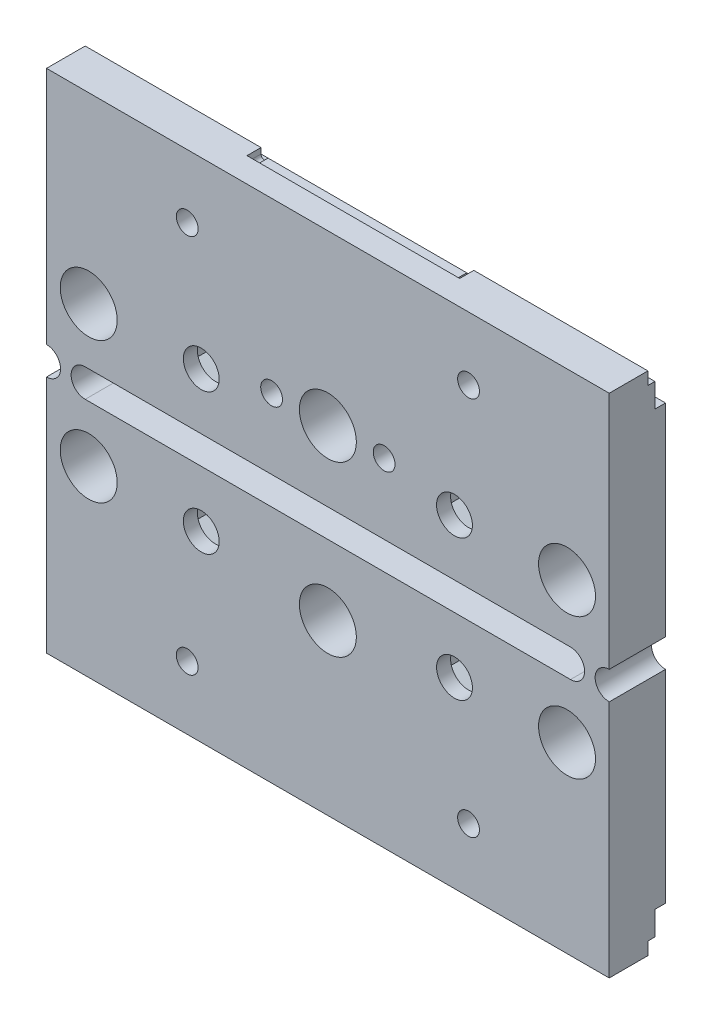
from build123d import *

# Parameters (mm, degrees)
SKETCH_2_W           = 80
SKETCH_2_H           = 34
SKETCH_2_R           = 4.05
EXTRUDE_1_DEPTH      = 8
SKETCH_3_R           = 2.55
CUT_EXTRUDE_1_DEPTH  = 88.292611371
CUT_EXTRUDE_2_DEPTH  = 88.292611371
SKETCH_5_R           = 1.55
CUT_EXTRUDE_3_DEPTH  = 88.292611371
CUT_EXTRUDE_4_DEPTH  = 6
CUT_EXTRUDE_5_DEPTH  = 4.5
SKETCH_25_R          = 1.55
CUT_EXTRUDE_13_DEPTH = 88.292611371
CUT_EXTRUDE_11_DEPTH = 2
EXTRUDE_2_DEPTH      = 8


with BuildPart() as part:
    # 草图2 → 凸台-拉伸1 (new body)
    with BuildSketch(Plane.XY):
        with Locations((40, 17)):
            Rectangle(SKETCH_2_W, SKETCH_2_H)
        with Locations((6, 8)):
            Circle(SKETCH_2_R, mode=Mode.SUBTRACT)
        with Locations((40, 10)):
            Circle(SKETCH_2_R, mode=Mode.SUBTRACT)
        with Locations((74, 8)):
            Circle(SKETCH_2_R, mode=Mode.SUBTRACT)
    extrude_1 = extrude(amount=EXTRUDE_1_DEPTH)

    # 草图3 → 切除-拉伸1 (cut, through all)
    with BuildSketch(Plane.XY.offset(8)):
        with Locations((22, 8)):
            Circle(SKETCH_3_R)
        with Locations((58, 8)):
            Circle(SKETCH_3_R)
    cut_extrude_1 = extrude(amount=-CUT_EXTRUDE_1_DEPTH, mode=Mode.SUBTRACT)

    # 草图4 → 切除-拉伸2 (cut, through all)
    with BuildSketch(Plane(origin=(80, 0, 0), x_dir=(0, 0, -1), z_dir=(1, 0, 0))):
        Polygon((-1.5, 32.2), (-2.5, 32.2), (-2.5, 34), (0, 34), (0, 28.8), (-1.5, 28.8), align=None)
    cut_extrude_2 = extrude(amount=-CUT_EXTRUDE_2_DEPTH, mode=Mode.SUBTRACT)

    # 草图5 → 切除-拉伸3 (cut, through all)
    with BuildSketch(Plane.XY.offset(8)):
        with Locations((48, 10)):
            Circle(SKETCH_5_R)
        with Locations((32, 10)):
            Circle(SKETCH_5_R)
    extrude(amount=-CUT_EXTRUDE_3_DEPTH, mode=Mode.SUBTRACT)

    # 草图7 → 切除-拉伸4 (cut)
    with BuildSketch(Plane(origin=(0, 0, 0), x_dir=(-1, 0, 0), z_dir=(0, 0, -1))):
        Polygon((-53.9, 5.632863896), (-53.9, 10.367136104), (-58, 12.734272207), (-62.1, 10.367136104), (-62.1, 5.632863896), (-58, 3.265727793), align=None)
        Polygon((-26.1, 5.632863896), (-22, 3.265727793), (-17.9, 5.632863896), (-17.9, 10.367136104), (-22, 12.734272207), (-26.1, 10.367136104), align=None)
    cut_extrude_4 = extrude(amount=-CUT_EXTRUDE_4_DEPTH, mode=Mode.SUBTRACT)

    # 草图8 → 切除-拉伸5 (cut)
    with BuildSketch(Plane(origin=(0, 0, 0), x_dir=(-1, 0, 0), z_dir=(0, 0, -1))):
        Polygon((-48, 6.709103466), (-45.15, 8.354551733), (-45.15, 11.645448267), (-48, 13.290896534), (-50.85, 11.645448267), (-50.85, 8.354551733), align=None)
        Polygon((-32, 6.709103466), (-29.15, 8.354551733), (-29.15, 11.645448267), (-32, 13.290896534), (-34.85, 11.645448267), (-34.85, 8.354551733), align=None)
    extrude(amount=-CUT_EXTRUDE_5_DEPTH, mode=Mode.SUBTRACT)

    # 草图25 → 切除-拉伸13 (cut, through all)
    with BuildSketch(Plane(origin=(0, 0, 0), x_dir=(-1, 0, 0), z_dir=(0, 0, -1))):
        with Locations((-60, 25)):
            Circle(SKETCH_25_R)
        with Locations((-20, 25)):
            Circle(SKETCH_25_R)
    cut_extrude_13 = extrude(amount=-CUT_EXTRUDE_13_DEPTH, mode=Mode.SUBTRACT)

    # 草图19 → 切除-拉伸11 (cut)
    with BuildSketch(Plane(origin=(0, 0, 2.5), x_dir=(-1, 0, 0), z_dir=(0, 0, -1))):
        with BuildLine():
            Line((-25, 34), (-55.247938178, 34))
            Line((-55.247938178, 34), (-55.247938178, 33.2))
            ThreePointArc((-55.247938178, 33.2), (-54.747938178, 32.7), (-54.247938178, 33.2))
            Line((-54.247938178, 33.2), (-26, 33.2))
            ThreePointArc((-26, 33.2), (-25.5, 32.7), (-25, 33.2))
            Line((-25, 33.2), (-25, 34))
        make_face()
    cut_extrude_11 = extrude(amount=-CUT_EXTRUDE_11_DEPTH, mode=Mode.SUBTRACT)

    # 草图22 → 凸台-拉伸2 (add)
    with BuildSketch(Plane.XY.offset(8)):
        with BuildLine():
            Line((0, -4), (5.5, -4))
            ThreePointArc((5.5, -4), (3.5, -2), (5.5, 0))
            Line((5.5, 0), (0, 0))
            ThreePointArc((0, 0), (2, -2), (0, -4))
        make_face()
        with BuildLine():
            Line((80, 0), (74.5, 0))
            ThreePointArc((74.5, 0), (76.5, -2), (74.5, -4))
            Line((74.5, -4), (80, -4))
            ThreePointArc((80, -4), (78, -2), (80, 0))
        make_face()
    extrude(amount=-EXTRUDE_2_DEPTH)

    # 镜向2: 凸台-拉伸1, 切除-拉伸1, 切除-拉伸2, 切除-拉伸4, 切除-拉伸13, 切除-拉伸11 across plane
    add(extrude_1.mirror(Plane(origin=(0, -2, 0), x_dir=(0, 0, 1), z_dir=(0, -1, 0))))
    add(cut_extrude_1.mirror(Plane(origin=(0, -2, 0), x_dir=(0, 0, 1), z_dir=(0, -1, 0))), mode=Mode.SUBTRACT)
    add(cut_extrude_2.mirror(Plane(origin=(0, -2, 0), x_dir=(0, 0, 1), z_dir=(0, -1, 0))), mode=Mode.SUBTRACT)
    add(cut_extrude_4.mirror(Plane(origin=(0, -2, 0), x_dir=(0, 0, 1), z_dir=(0, -1, 0))), mode=Mode.SUBTRACT)
    add(cut_extrude_13.mirror(Plane(origin=(0, -2, 0), x_dir=(0, 0, 1), z_dir=(0, -1, 0))), mode=Mode.SUBTRACT)
    add(cut_extrude_11.mirror(Plane(origin=(0, -2, 0), x_dir=(0, 0, 1), z_dir=(0, -1, 0))), mode=Mode.SUBTRACT)


solid = part.part
